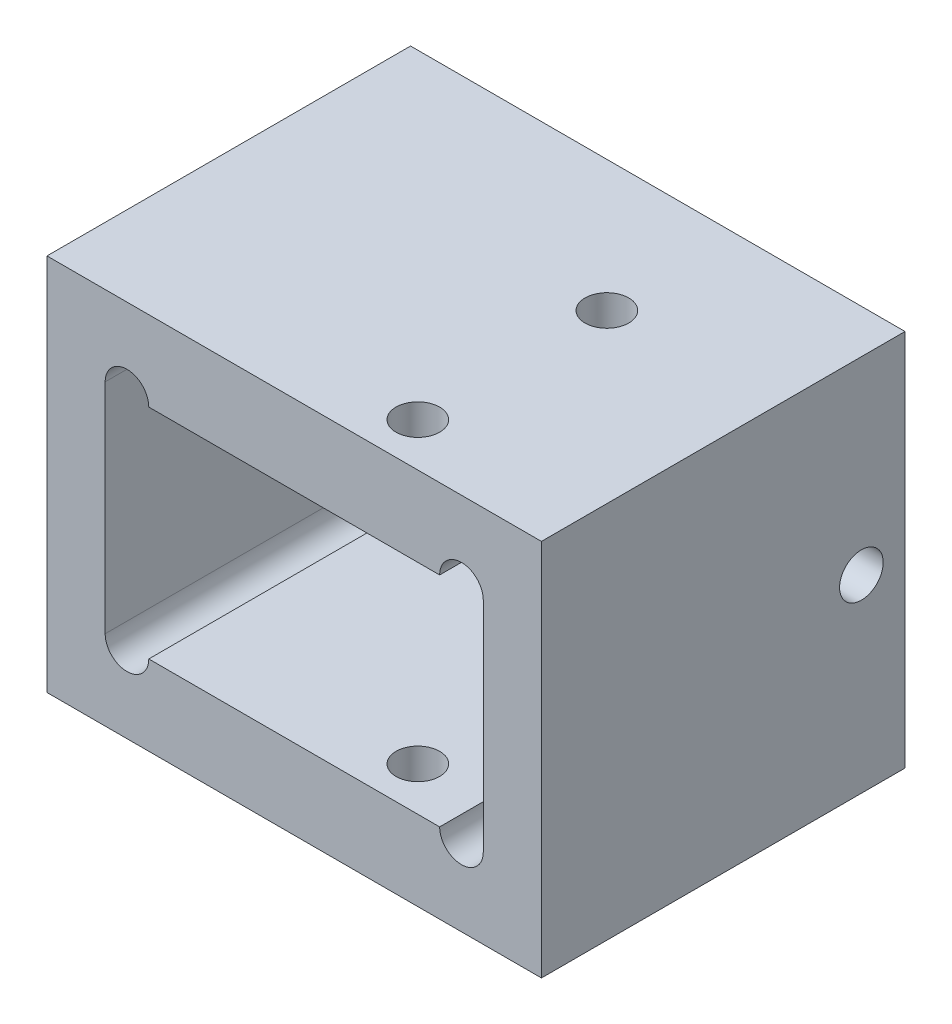
from build123d import *

# Parameters (mm, degrees)
SKETCH_1_W               = 34
SKETCH_1_H               = 26
SKETCH_1_W_2             = 26
SKETCH_1_H_2             = 15
EXTRUDE_1_DEPTH          = 25
SKETCH_2_R               = 1.5
CUT_EXTRUDE_1_DEPTH      = 45.158804332
SKETCH_3_R               = 2.5
CUT_EXTRUDE_2_DEPTH      = 4
CUT_EXTRUDE_4_DEPTH      = 47.917480751
CUT_EXTRUDE_4_DEPTH_BACK = 47.917480751
SKETCH_5_R               = 1.5
SKETCH_6_R               = 1.5
CUT_EXTRUDE_5_DEPTH      = 45.158804332


with BuildPart() as part:
    # 草图1 → 凸台-拉伸1 (new body)
    with BuildSketch(Plane.XY):
        with Locations((17, 0)):
            Rectangle(SKETCH_1_W, SKETCH_1_H)
        with Locations((17, 0)):
            Rectangle(SKETCH_1_W_2, SKETCH_1_H_2, mode=Mode.SUBTRACT)
    extrude(amount=EXTRUDE_1_DEPTH)

    # 草图2 → 切除-拉伸1 (cut, through all)
    with BuildSketch(Plane.XY.offset(25)):
        with Locations((5.5, 7.5)):
            Circle(SKETCH_2_R)
        with Locations((5.5, -7.5)):
            Circle(SKETCH_2_R)
        with Locations((28.5, -7.5)):
            Circle(SKETCH_2_R)
        with Locations((28.5, 7.5)):
            Circle(SKETCH_2_R)
    extrude(amount=-CUT_EXTRUDE_1_DEPTH, mode=Mode.SUBTRACT)

    # 草图3 → 切除-拉伸2 (cut)
    with BuildSketch(Plane.ZY):
        with Locations((10, 0)):
            Circle(SKETCH_3_R)
    extrude(amount=-CUT_EXTRUDE_2_DEPTH, mode=Mode.SUBTRACT)

    # 草图5 → 切除-拉伸4 (cut, two sides: drawn at the far end of the back side and taken through both)
    with BuildSketch(Plane(origin=(0, -7.5, 0), x_dir=(1, 0, 0), z_dir=(0, 1, 0)).offset(-CUT_EXTRUDE_4_DEPTH_BACK)):
        with Locations(Location((22.5, -22, 0), (0, 0, 270))):
            Circle(SKETCH_5_R)
        with Locations(Location((22.5, -9, 0), (0, 0, 270))):
            Circle(SKETCH_5_R)
    extrude(amount=CUT_EXTRUDE_4_DEPTH + CUT_EXTRUDE_4_DEPTH_BACK, mode=Mode.SUBTRACT)

    # 草图6 → 切除-拉伸5 (cut, through all)
    with BuildSketch(Plane(origin=(34, 0, 0), x_dir=(0, 0, -1), z_dir=(1, 0, 0))):
        with Locations((-3, 0)):
            Circle(SKETCH_6_R)
    extrude(amount=-CUT_EXTRUDE_5_DEPTH, mode=Mode.SUBTRACT)


solid = part.part
